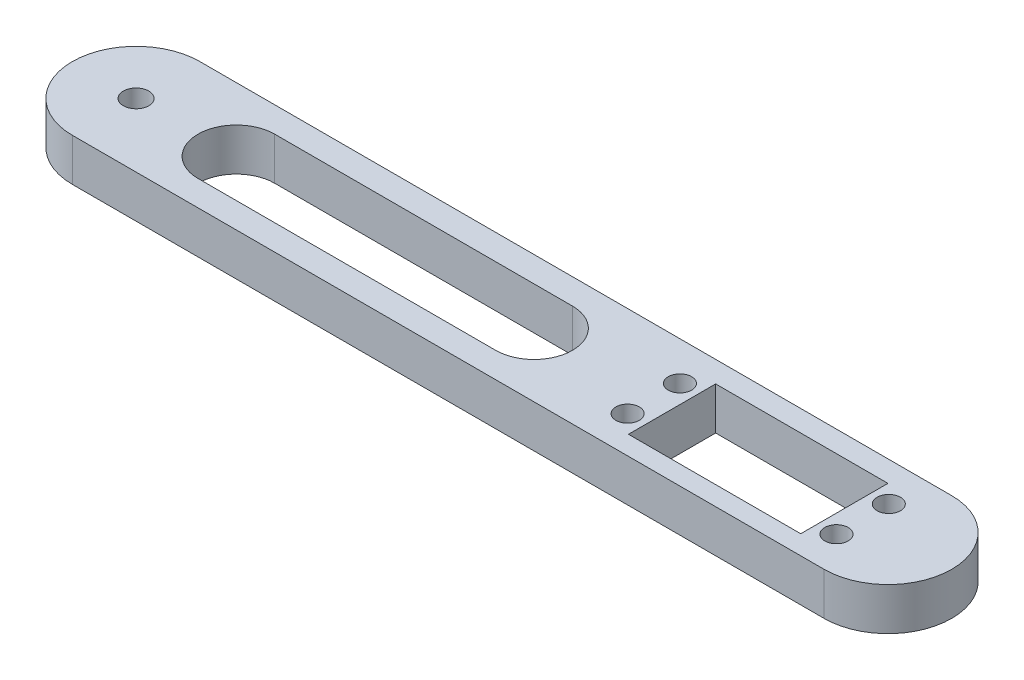
from build123d import *

# Parameters (mm, degrees)
SKETCH2_R           = 1.45
BOSS_EXTRUDE3_DEPTH = 10
SKETCH10_W          = 7.047144721
SKETCH10_H          = 19.860135122
BOSS_EXTRUDE7_DEPTH = 10
SKETCH12_R          = 1.45
BOSS_EXTRUDE8_DEPTH = 10
SKETCH13_R          = 2.925
CUT_EXTRUDE8_DEPTH  = 2
CUT_EXTRUDE9_DEPTH  = 10
SKETCH16_R          = 3
CUT_EXTRUDE10_DEPTH = 10
SKETCH6_R           = 2.75
SKETCH6_W           = 40.5
SKETCH6_H           = 20.5
CUT_EXTRUDE11_DEPTH = 10
SKETCH17_R          = 2.75
CUT_EXTRUDE12_DEPTH = 10


with BuildPart() as part:
    # Sketch2 → Boss-Extrude3 (new body)
    with BuildSketch(Plane(origin=(0, 0, 0), x_dir=(1, 0, 0), z_dir=(0, 1, 0))):
        with BuildLine():
            Line((0, 15), (100, 15))
            ThreePointArc((100, 15), (115, 0), (100, -15))
            Line((100, -15), (0, -15))
            ThreePointArc((0, -15), (-15, 0), (0, 15))
        make_face()
        with Locations(Location((0, 0, 0), (0, 0, 270))):
            Circle(SKETCH2_R, mode=Mode.SUBTRACT)
    extrude(amount=BOSS_EXTRUDE3_DEPTH)

    # Sketch10 → Boss-Extrude7 (add)
    with BuildSketch(Plane(origin=(0, 10, 0), x_dir=(1, 0, 0), z_dir=(0, 1, 0))):
        with Locations((94.781401452, 0.828180391)):
            Rectangle(SKETCH10_W, SKETCH10_H)
    extrude(amount=-BOSS_EXTRUDE7_DEPTH)

    # Sketch12 → Boss-Extrude8 (add)
    with BuildSketch(Plane(origin=(0, 10, 0), x_dir=(1, 0, 0), z_dir=(0, 1, 0))):
        with BuildLine():
            Line((-76.756351439, 15), (12.176052336, 15))
            ThreePointArc((12.176052336, 15), (27.176052336, 0), (12.176052336, -15))
            Line((12.176052336, -15), (-76.756351439, -15))
            ThreePointArc((-76.756351439, -15), (-91.756351439, 0), (-76.756351439, 15))
        make_face()
        with Locations(Location((-76.756351439, 0, 0), (0, 0, 270))):
            Circle(SKETCH12_R, mode=Mode.SUBTRACT)
    extrude(amount=-BOSS_EXTRUDE8_DEPTH)

    # Sketch13 → Cut-Extrude8 (cut)
    with BuildSketch(Plane(origin=(0, 10, 0), x_dir=(1, 0, 0), z_dir=(0, 1, 0))):
        with Locations(Location((-76.756351439, 0, 0), (0, 0, 270))):
            Circle(SKETCH13_R)
    extrude(amount=-CUT_EXTRUDE8_DEPTH, mode=Mode.SUBTRACT)

    # Sketch15 → Cut-Extrude9 (cut)
    with BuildSketch(Plane(origin=(0, 10, 0), x_dir=(1, 0, 0), z_dir=(0, 1, 0))):
        with BuildLine():
            Line((-53.180879761, 9.018176556), (16.819120239, 9.018176556))
            ThreePointArc((16.819120239, 9.018176556), (25.837296795, 0), (16.819120239, -9.018176556))
            Line((16.819120239, -9.018176556), (-53.180879761, -9.018176556))
            ThreePointArc((-53.180879761, -9.018176556), (-62.199056317, 0), (-53.180879761, 9.018176556))
        make_face()
    extrude(amount=-CUT_EXTRUDE9_DEPTH, mode=Mode.SUBTRACT)

    # Sketch16 → Cut-Extrude10 (cut)
    with BuildSketch(Plane(origin=(0, 10, 0), x_dir=(1, 0, 0), z_dir=(0, 1, 0))):
        with Locations(Location((-76.756351439, 0, 0), (0, 0, 270))):
            Circle(SKETCH16_R)
    extrude(amount=-CUT_EXTRUDE10_DEPTH, mode=Mode.SUBTRACT)

    # Sketch6 → Cut-Extrude11 (cut)
    with BuildSketch(Plane(origin=(0, 10, 0), x_dir=(1, 0, 0), z_dir=(0, 1, 0))):
        with Locations(Location((94.301250031, 5.9, 0), (0, 0, 270))):
            Circle(SKETCH6_R)
        with Locations(Location((94.301250031, -6.4, 0), (0, 0, 270))):
            Circle(SKETCH6_R)
        with Locations((69.751250031, -0.25)):
            Rectangle(SKETCH6_W, SKETCH6_H)
    extrude(amount=-CUT_EXTRUDE11_DEPTH, mode=Mode.SUBTRACT)

    # Sketch17 → Cut-Extrude12 (cut)
    with BuildSketch(Plane(origin=(0, 10, 0), x_dir=(1, 0, 0), z_dir=(0, 1, 0))):
        with Locations(Location((45.201250031, 5.9, 0), (0, 0, 270))):
            Circle(SKETCH17_R)
        with Locations(Location((45.201250031, -6.4, 0), (0, 0, 270))):
            Circle(SKETCH17_R)
    extrude(amount=-CUT_EXTRUDE12_DEPTH, mode=Mode.SUBTRACT)


solid = part.part
